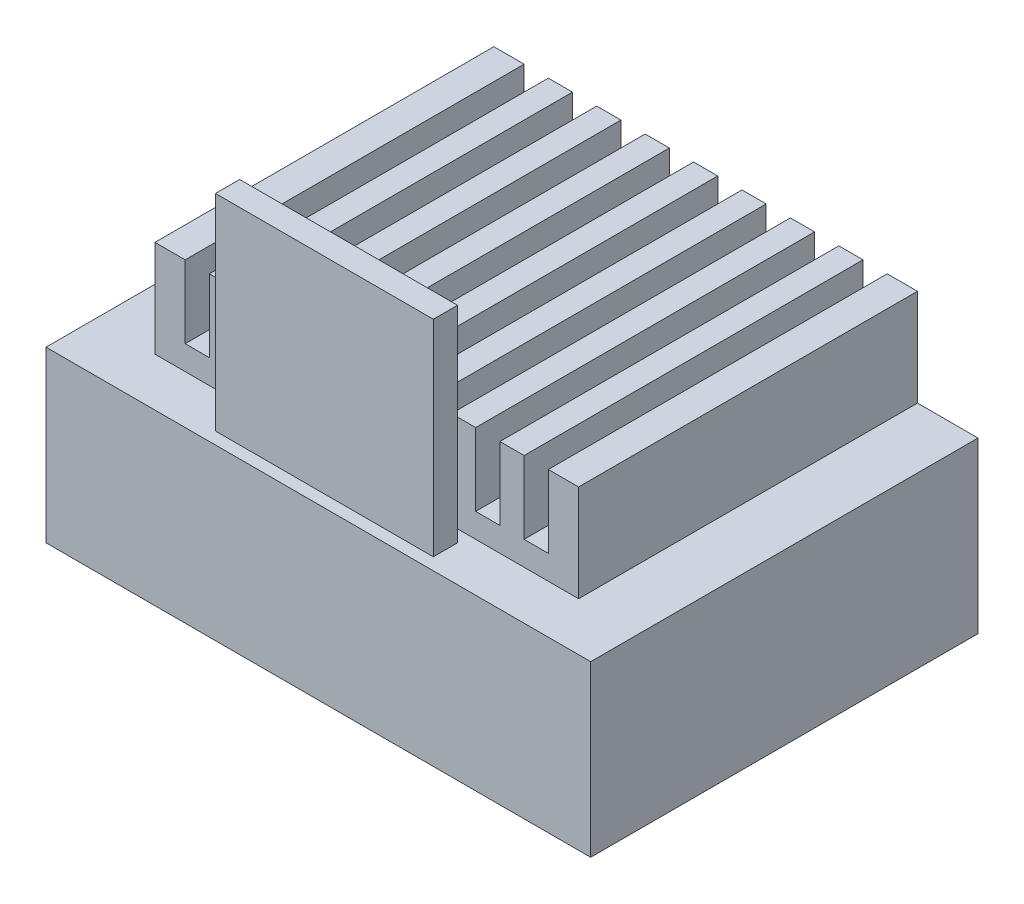
from build123d import *

# Parameters (mm, degrees)
SKETCH1_W           = 45
SKETCH1_H           = 32
BOSS_EXTRUDE1_DEPTH = 14
SKETCH5_W           = 35
SKETCH5_H           = 28
BOSS_EXTRUDE2_DEPTH = 8
SKETCH8_W           = 2
SKETCH8_H           = 28
CUT_EXTRUDE2_DEPTH  = 6
LPATTERN3_COUNT     = 8
LPATTERN3_PITCH     = 4
SKETCH9_W           = 18
SKETCH9_H           = 2
BOSS_EXTRUDE3_DEPTH = 17


with BuildPart() as part:
    # Sketch1 → Boss-Extrude1 (new body)
    with BuildSketch(Plane(origin=(0, 0, 0), x_dir=(1, 0, 0), z_dir=(0, 1, 0))):
        Rectangle(SKETCH1_W, SKETCH1_H)
    extrude(amount=-BOSS_EXTRUDE1_DEPTH)

    # Sketch9 → Boss-Extrude3 (add)
    with BuildSketch(Plane(origin=(0, 0, 0), x_dir=(1, 0, 0), z_dir=(0, 1, 0))):
        with Locations((-0.5, -14)):
            Rectangle(SKETCH9_W, SKETCH9_H)
    extrude(amount=BOSS_EXTRUDE3_DEPTH)


with BuildPart() as body_2:
    # Sketch5 → Boss-Extrude2 (new body)
    with BuildSketch(Plane(origin=(0, 0, 0), x_dir=(1, 0, 0), z_dir=(0, 1, 0))):
        with Locations((0, 2)):
            Rectangle(SKETCH5_W, SKETCH5_H)
    extrude(amount=BOSS_EXTRUDE2_DEPTH)

    # Sketch8 → Cut-Extrude2 (cut)
    with BuildSketch(Plane(origin=(0, 8, 0), x_dir=(1, 0, 0), z_dir=(0, 1, 0))):
        with Locations((-14, 2)):
            Rectangle(SKETCH8_W, SKETCH8_H)
    cut_extrude2 = extrude(amount=-CUT_EXTRUDE2_DEPTH, mode=Mode.SUBTRACT)

    # LPattern3: Cut-Extrude2 ×8
    with Locations(*[(i * LPATTERN3_PITCH, 0, 0) for i in range(1, LPATTERN3_COUNT)]):
        add(cut_extrude2, mode=Mode.SUBTRACT)


solid = Compound([part.part, body_2.part])
